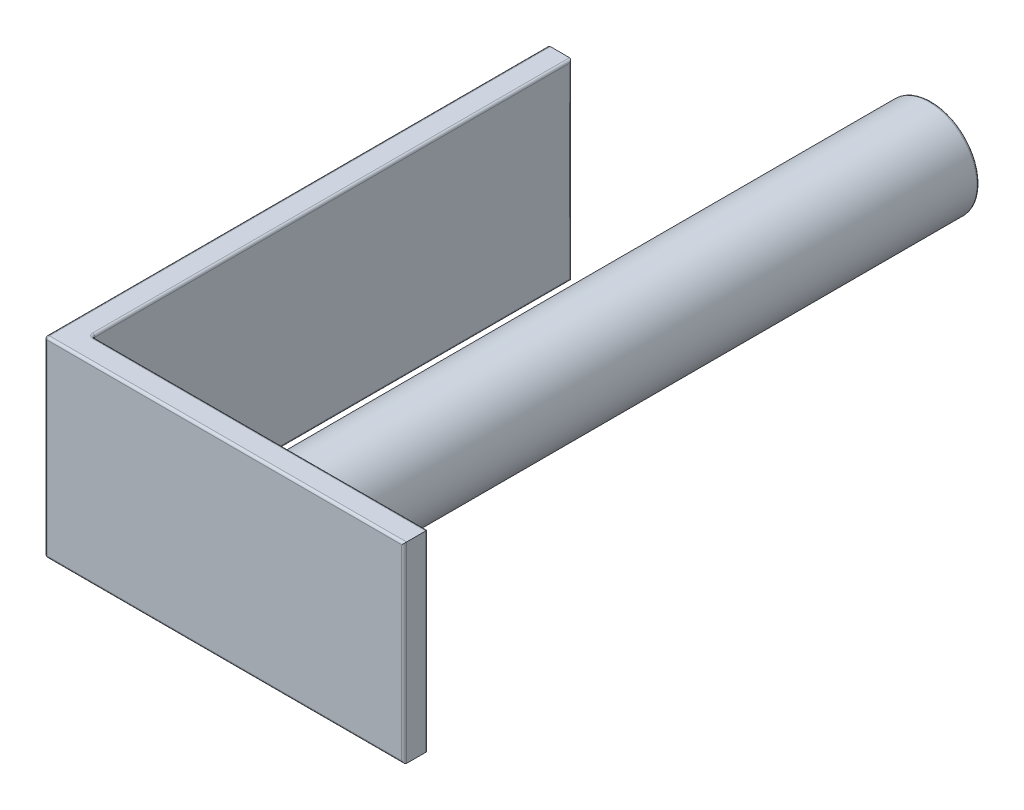
from build123d import *

# Parameters (mm, degrees)
SKETCH1_R           = 50.8
BOSS_EXTRUDE1_DEPTH = 711.2
EXTRUDE_THIN1_DEPTH = 101.6
FILLET1_R           = 2.54


with BuildPart() as part:
    # Sketch1 → Boss-Extrude1 (new body)
    with BuildSketch(Plane.XY):
        Circle(SKETCH1_R)
    extrude(amount=-BOSS_EXTRUDE1_DEPTH)

    # Sketch3 → Extrude-Thin1 (add, symmetric)
    with BuildSketch(Plane(origin=(0, 0, 0), x_dir=(1, 0, 0), z_dir=(0, 1, 0))):
        Polygon((177.8, 0), (-177.8, 0), (-177.8, 508), (-203.2, 508), (-203.2, -25.4), (177.8, -25.4), align=None)
    extrude(amount=EXTRUDE_THIN1_DEPTH, both=True)

    # Fillet1
    fillet1_edges = [part.edges().sort_by_distance(p)[0] for p in [
        (-50.8, 0, 0),
        (-50.8, 0, -711.2),
        (-177.8, -101.6, -254),
        (-177.8, 0, 0),
        (-177.8, 0, -508),
        (-203.2, 101.6, -241.3),
        (-203.2, 0, -508),
        (-12.7, 101.6, 25.4),
        (-203.2, 0, 25.4),
        (177.8, 0, 25.4),
        (0, -101.6, 0),
        (177.8, 0, 0),
        (-177.8, 101.6, -254),
        (0, 101.6, 0),
        (-12.7, -101.6, 25.4),
        (-203.2, -101.6, -241.3),
    ]]
    fillet(fillet1_edges, radius=FILLET1_R)


solid = part.part
